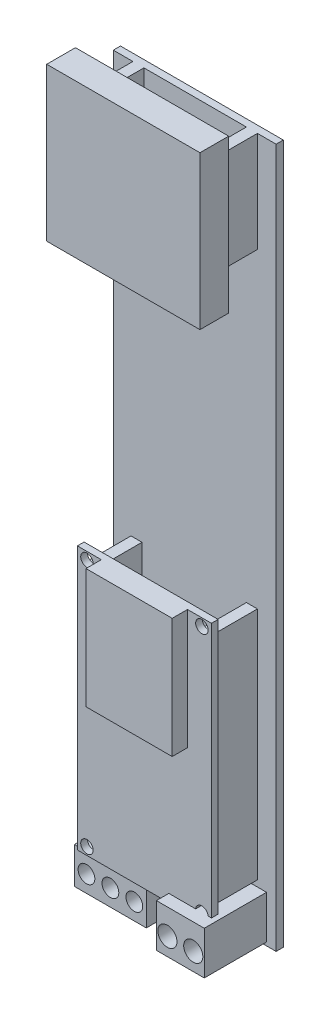
from build123d import *

# Parameters (mm, degrees)
SKICA1_W                    = 34
SKICA1_H                    = 146
PCB_DEPTH                   = 1.5
SKICA2_W                    = 10
SKICA2_H                    = 9
T_LO_DEPTH                  = 13
SKICA3_W                    = 4.2
SKICA3_H                    = 6.4
D_RA_NA_DR_TKY_DEPTH        = 6
SKICA4_R                    = 2
D_RY_NA_ROUBKY_DEPTH        = 5.2
SKICA5_W                    = 15
SKICA5_H                    = 7.6
T_LO_LOGIKY_KONEKTORU_DEPTH = 10
SKICA6_W                    = 4.2
SKICA6_H                    = 5.5
D_RY_NA_DR_TKY_DEPTH        = 6
SKICA7_R                    = 1.75
D_RY_NA_KOUBKY_DEPTH        = 4
SKICA8_W                    = 2.3
SKICA8_H                    = 49
LI_TY_DEPTH                 = 9
SKICA9_W                    = 28
SKICA9_H                    = 55
SKICA9_R                    = 1.3
PCB_ESP32_BOARD_DEPTH       = 1.4
SKICA10_W                   = 18
SKICA10_H                   = 25
CHIP_ESP32_DEPTH            = 3.2
SKICA11_W                   = 2.3
SKICA11_H                   = 21
LISTY_DEPTH                 = 9
SKICA12_W                   = 32
SKICA12_H                   = 32
F_8X8_LED_MATICE_DEPTH      = 6


with BuildPart() as part:
    # Skica1 → PCB (new body)
    with BuildSketch(Plane.XY):
        with Locations((17, 73)):
            Rectangle(SKICA1_W, SKICA1_H)
    extrude(amount=PCB_DEPTH)

    # Skica2 → tělo (add)
    with BuildSketch(Plane.XY.offset(1.5)):
        with Locations((27, 5.2)):
            Rectangle(SKICA2_W, SKICA2_H)
    extrude(amount=T_LO_DEPTH)

    # Skica3 → díra na drátky (cut)
    with BuildSketch(Plane.XZ.offset(-0.7)):
        with Locations((24.5, 6.1)):
            Rectangle(SKICA3_W, SKICA3_H)
        with Locations((29.5, 6.1)):
            Rectangle(SKICA3_W, SKICA3_H)
    extrude(amount=-D_RA_NA_DR_TKY_DEPTH, mode=Mode.SUBTRACT)

    # Skica4 → díry na šroubky (cut)
    with BuildSketch(Plane.XY.offset(14.5)):
        with Locations((29.7, 4.4)):
            Circle(SKICA4_R)
        with Locations((24.3, 4.4)):
            Circle(SKICA4_R)
    extrude(amount=-D_RY_NA_ROUBKY_DEPTH, mode=Mode.SUBTRACT)

    # Skica5 → tělo logiky konektoru (add)
    with BuildSketch(Plane.XY.offset(1.5)):
        with Locations((9.4, 4.5)):
            Rectangle(SKICA5_W, SKICA5_H)
    extrude(amount=T_LO_LOGIKY_KONEKTORU_DEPTH)

    # Skica6 → díry na drátky (cut)
    with BuildSketch(Plane.XZ.offset(-0.7)):
        with Locations((4.5, 4.75)):
            Rectangle(SKICA6_W, SKICA6_H)
        with Locations((9.4, 4.75)):
            Rectangle(SKICA6_W, SKICA6_H)
        with Locations((14.3, 4.75)):
            Rectangle(SKICA6_W, SKICA6_H)
    extrude(amount=-D_RY_NA_DR_TKY_DEPTH, mode=Mode.SUBTRACT)

    # Skica7 → díry na škoubky (cut)
    with BuildSketch(Plane.XY.offset(11.5)):
        with Locations((4.4, 4.2)):
            Circle(SKICA7_R)
        with Locations((9.4, 4.2)):
            Circle(SKICA7_R)
        with Locations((14.4, 4.2)):
            Circle(SKICA7_R)
    extrude(amount=-D_RY_NA_KOUBKY_DEPTH, mode=Mode.SUBTRACT)

    # Skica8 → lišty (add)
    with BuildSketch(Plane.XY.offset(1.5)):
        with Locations((4.85, 35.5)):
            Rectangle(SKICA8_W, SKICA8_H)
        with Locations((28.95, 35.5)):
            Rectangle(SKICA8_W, SKICA8_H)
    extrude(amount=LI_TY_DEPTH)



with BuildPart() as body_2:
    # Skica9 → PCB ESP32 board (new body)
    with BuildSketch(Plane.XY.offset(10.5)):
        with Locations((16.9, 35.5)):
            Rectangle(SKICA9_W, SKICA9_H)
        with Locations((28.9, 61.4)):
            Circle(SKICA9_R, mode=Mode.SUBTRACT)
        with Locations((4.9, 61.4)):
            Circle(SKICA9_R, mode=Mode.SUBTRACT)
        with Locations((4.9, 9.6)):
            Circle(SKICA9_R, mode=Mode.SUBTRACT)
        with Locations((28.9, 9.6)):
            Circle(SKICA9_R, mode=Mode.SUBTRACT)
    extrude(amount=PCB_ESP32_BOARD_DEPTH)


with BuildPart() as part_1:
    add(part.part)

    add(body_2.part)  # chip ESP32 merges body 2
    # Skica10 → chip ESP32 (add)
    with BuildSketch(Plane.XY.offset(11.9)):
        with Locations((16.9, 50.5)):
            Rectangle(SKICA10_W, SKICA10_H)
    extrude(amount=CHIP_ESP32_DEPTH)

    # Skica11 → listy (add)
    with BuildSketch(Plane.XY.offset(1.5)):
        with Locations((28.95, 135.5)):
            Rectangle(SKICA11_W, SKICA11_H)
        with Locations((5.25, 135.5)):
            Rectangle(SKICA11_W, SKICA11_H)
    extrude(amount=LISTY_DEPTH)

    # Skica12 → 8x8 LED matice (add)
    with BuildSketch(Plane.XY.offset(10.5)):
        with Locations((17.1, 135.5)):
            Rectangle(SKICA12_W, SKICA12_H)
    extrude(amount=F_8X8_LED_MATICE_DEPTH)


solid = part_1.part
